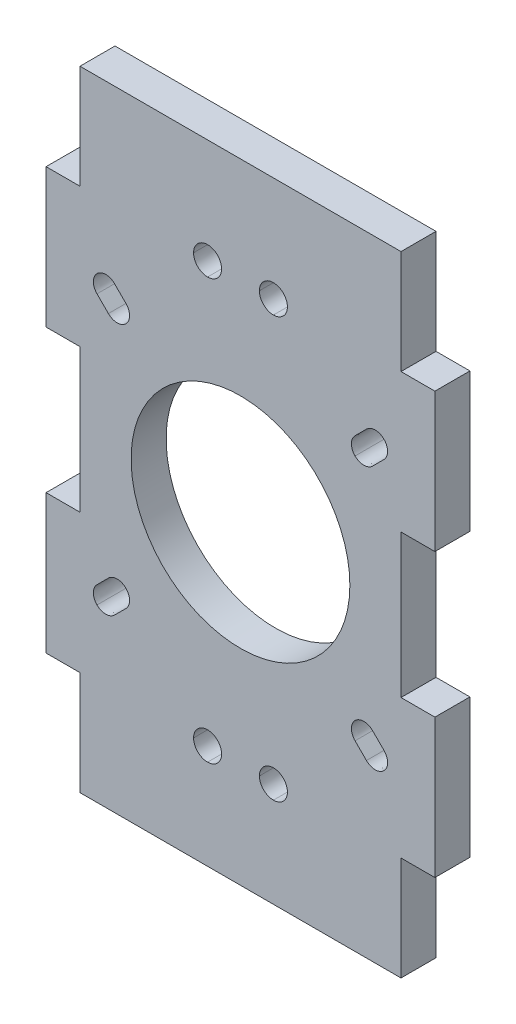
from build123d import *

# Parameters (mm, degrees)
MODEL_R             = 19.8387
BOSS_EXTRUDE1_DEPTH = 6.35


with BuildPart() as part:
    # Model → Boss-Extrude1 (new body)
    with BuildSketch(Plane.XY):
        Polygon((-20.5954, 132.4124), (-26.7451, 132.4124), (-26.7451, 151.262), (-84.9649, 151.262), (-84.9649, 132.4124), (-91.1147, 132.4124), (-91.1147, 107.2136), (-84.9649, 107.2136), (-84.9649, 81.2129), (-91.1147, 81.2129), (-91.1147, 56.0124), (-84.9649, 56.0124), (-84.9649, 37.1628), (-26.7451, 37.1628), (-26.7451, 56.0124), (-20.5954, 56.0124), (-20.5954, 81.2129), (-26.7451, 81.2129), (-26.7451, 107.2136), (-20.5954, 107.2136), align=None)
        with Locations((-55.8552, 94.2124)):
            Circle(MODEL_R, mode=Mode.SUBTRACT)
        with BuildLine():
            Line((-76.6319, 70.2547), (-78.6976, 68.1899))
            add(Edge.make_bspline(
                [(-78.6976, 68.1899), (-79.578, 67.3086), (-80.9971, 67.3086), (-81.878, 68.1903)],
                knots=[0.142857143, 0.142857143, 0.142857143, 0.142857143, 0.285714286, 0.285714286, 0.285714286, 0.285714286], degree=3))
            add(Edge.make_bspline(
                [(-81.878, 68.1903), (-82.7596, 69.0707), (-82.7601, 70.4902), (-81.878, 71.3707)],
                knots=[0.285714286, 0.285714286, 0.285714286, 0.285714286, 0.428571429, 0.428571429, 0.428571429, 0.428571429], degree=3))
            Line((-81.878, 71.3707), (-79.8123, 73.4364))
            add(Edge.make_bspline(
                [(-79.8123, 73.4364), (-78.9314, 74.3172), (-77.5119, 74.3172), (-76.6315, 73.4364)],
                knots=[0.571428571, 0.571428571, 0.571428571, 0.571428571, 0.714285714, 0.714285714, 0.714285714, 0.714285714], degree=3))
            add(Edge.make_bspline(
                [(-76.6315, 73.4364), (-75.7498, 72.5547), (-75.7498, 71.1368), (-76.6319, 70.2547)],
                knots=[0.714285714, 0.714285714, 0.714285714, 0.714285714, 1, 1, 1, 1], degree=3))
        make_face(mode=Mode.SUBTRACT)
        with BuildLine():
            Line((-29.8321, 117.0554), (-31.897, 114.9897))
            add(Edge.make_bspline(
                [(-31.897, 114.9897), (-32.7791, 114.1076), (-34.1965, 114.1076), (-35.0782, 114.9897)],
                knots=[0.142857143, 0.142857143, 0.142857143, 0.142857143, 0.285714286, 0.285714286, 0.285714286, 0.285714286], degree=3))
            add(Edge.make_bspline(
                [(-35.0782, 114.9897), (-35.959, 115.8705), (-35.959, 117.2896), (-35.0782, 118.1705)],
                knots=[0.285714286, 0.285714286, 0.285714286, 0.285714286, 0.428571429, 0.428571429, 0.428571429, 0.428571429], degree=3))
            Line((-35.0782, 118.1705), (-33.0129, 120.2357))
            add(Edge.make_bspline(
                [(-33.0129, 120.2357), (-32.1324, 121.1178), (-30.7129, 121.1178), (-29.8321, 120.2357)],
                knots=[0.571428571, 0.571428571, 0.571428571, 0.571428571, 0.714285714, 0.714285714, 0.714285714, 0.714285714], degree=3))
            add(Edge.make_bspline(
                [(-29.8321, 120.2357), (-28.95, 119.3553), (-28.9504, 117.9362), (-29.8321, 117.0554)],
                knots=[0.714285714, 0.714285714, 0.714285714, 0.714285714, 1, 1, 1, 1], degree=3))
        make_face(mode=Mode.SUBTRACT)
        with BuildLine():
            Line((-29.8321, 71.3707), (-31.8965, 73.4364))
            add(Edge.make_bspline(
                [(-31.8965, 73.4364), (-32.7786, 74.3172), (-34.1969, 74.3172), (-35.0786, 73.4364)],
                knots=[0.142857143, 0.142857143, 0.142857143, 0.142857143, 0.285714286, 0.285714286, 0.285714286, 0.285714286], degree=3))
            add(Edge.make_bspline(
                [(-35.0786, 73.4364), (-35.959, 72.5547), (-35.959, 71.1364), (-35.0786, 70.2543)],
                knots=[0.285714286, 0.285714286, 0.285714286, 0.285714286, 0.428571429, 0.428571429, 0.428571429, 0.428571429], degree=3))
            Line((-35.0786, 70.2543), (-33.0129, 68.1899))
            add(Edge.make_bspline(
                [(-33.0129, 68.1899), (-32.1324, 67.3082), (-30.7129, 67.3086), (-29.8325, 68.1903)],
                knots=[0.571428571, 0.571428571, 0.571428571, 0.571428571, 0.714285714, 0.714285714, 0.714285714, 0.714285714], degree=3))
            add(Edge.make_bspline(
                [(-29.8325, 68.1903), (-28.9504, 69.0707), (-28.95, 70.4902), (-29.8321, 71.3707)],
                knots=[0.714285714, 0.714285714, 0.714285714, 0.714285714, 1, 1, 1, 1], degree=3))
        make_face(mode=Mode.SUBTRACT)
        with BuildLine():
            Line((-76.6319, 118.1705), (-78.6976, 120.2357))
            add(Edge.make_bspline(
                [(-78.6976, 120.2357), (-79.578, 121.1178), (-80.9975, 121.1178), (-81.878, 120.2357)],
                knots=[0.142857143, 0.142857143, 0.142857143, 0.142857143, 0.285714286, 0.285714286, 0.285714286, 0.285714286], degree=3))
            add(Edge.make_bspline(
                [(-81.878, 120.2357), (-82.7601, 119.3553), (-82.7601, 117.9358), (-81.878, 117.0554)],
                knots=[0.285714286, 0.285714286, 0.285714286, 0.285714286, 0.428571429, 0.428571429, 0.428571429, 0.428571429], degree=3))
            Line((-81.878, 117.0554), (-79.8127, 114.9897))
            add(Edge.make_bspline(
                [(-79.8127, 114.9897), (-78.9322, 114.1076), (-77.5123, 114.1076), (-76.6319, 114.9897)],
                knots=[0.571428571, 0.571428571, 0.571428571, 0.571428571, 0.714285714, 0.714285714, 0.714285714, 0.714285714], degree=3))
            add(Edge.make_bspline(
                [(-76.6319, 114.9897), (-75.7498, 115.8705), (-75.7498, 117.29), (-76.6319, 118.1705)],
                knots=[0.714285714, 0.714285714, 0.714285714, 0.714285714, 1, 1, 1, 1], degree=3))
        make_face(mode=Mode.SUBTRACT)
        with BuildLine():
            add(Edge.make_bspline(
                [(-61.8264, 129.7262), (-60.4231, 129.7262), (-59.2852, 130.8633), (-59.2852, 132.2662)],
                knots=[0, 0, 0, 0, 0.2, 0.2, 0.2, 0.2], degree=3))
            add(Edge.make_bspline(
                [(-59.2852, 132.2662), (-59.2852, 133.6691), (-60.4231, 134.8074), (-61.8264, 134.8074)],
                knots=[0.2, 0.2, 0.2, 0.2, 0.4, 0.4, 0.4, 0.4], degree=3))
            add(Edge.make_bspline(
                [(-61.8264, 134.8074), (-63.2289, 134.8074), (-64.366, 133.6691), (-64.366, 132.2662)],
                knots=[0.4, 0.4, 0.4, 0.4, 0.6, 0.6, 0.6, 0.6], degree=3))
            add(Edge.make_bspline(
                [(-64.366, 132.2662), (-64.366, 130.8633), (-63.2289, 129.7262), (-61.8264, 129.7262)],
                knots=[0.6, 0.6, 0.6, 0.6, 1, 1, 1, 1], degree=3))
        make_face(mode=Mode.SUBTRACT)
        with BuildLine():
            add(Edge.make_bspline(
                [(-61.8264, 53.5264), (-60.4231, 53.5264), (-59.2852, 54.6635), (-59.2852, 56.0664)],
                knots=[0, 0, 0, 0, 0.2, 0.2, 0.2, 0.2], degree=3))
            add(Edge.make_bspline(
                [(-59.2852, 56.0664), (-59.2852, 57.4693), (-60.4231, 58.6076), (-61.8264, 58.6076)],
                knots=[0.2, 0.2, 0.2, 0.2, 0.4, 0.4, 0.4, 0.4], degree=3))
            add(Edge.make_bspline(
                [(-61.8264, 58.6076), (-63.2289, 58.6076), (-64.366, 57.4693), (-64.366, 56.0664)],
                knots=[0.4, 0.4, 0.4, 0.4, 0.6, 0.6, 0.6, 0.6], degree=3))
            add(Edge.make_bspline(
                [(-64.366, 56.0664), (-64.366, 54.6635), (-63.2289, 53.5264), (-61.8264, 53.5264)],
                knots=[0.6, 0.6, 0.6, 0.6, 1, 1, 1, 1], degree=3))
        make_face(mode=Mode.SUBTRACT)
        with BuildLine():
            add(Edge.make_bspline(
                [(-49.884, 129.7262), (-48.4812, 129.7262), (-47.3445, 130.8633), (-47.3445, 132.2662)],
                knots=[0, 0, 0, 0, 0.2, 0.2, 0.2, 0.2], degree=3))
            add(Edge.make_bspline(
                [(-47.3445, 132.2662), (-47.3445, 133.6691), (-48.4812, 134.8074), (-49.884, 134.8074)],
                knots=[0.2, 0.2, 0.2, 0.2, 0.4, 0.4, 0.4, 0.4], degree=3))
            add(Edge.make_bspline(
                [(-49.884, 134.8074), (-51.2869, 134.8074), (-52.424, 133.6691), (-52.424, 132.2662)],
                knots=[0.4, 0.4, 0.4, 0.4, 0.6, 0.6, 0.6, 0.6], degree=3))
            add(Edge.make_bspline(
                [(-52.424, 132.2662), (-52.424, 130.8633), (-51.2869, 129.7262), (-49.884, 129.7262)],
                knots=[0.6, 0.6, 0.6, 0.6, 1, 1, 1, 1], degree=3))
        make_face(mode=Mode.SUBTRACT)
        with BuildLine():
            add(Edge.make_bspline(
                [(-49.884, 53.5264), (-48.4812, 53.5264), (-47.3445, 54.6635), (-47.3445, 56.0664)],
                knots=[0, 0, 0, 0, 0.2, 0.2, 0.2, 0.2], degree=3))
            add(Edge.make_bspline(
                [(-47.3445, 56.0664), (-47.3445, 57.4693), (-48.4812, 58.6076), (-49.884, 58.6076)],
                knots=[0.2, 0.2, 0.2, 0.2, 0.4, 0.4, 0.4, 0.4], degree=3))
            add(Edge.make_bspline(
                [(-49.884, 58.6076), (-51.2869, 58.6076), (-52.424, 57.4693), (-52.424, 56.0664)],
                knots=[0.4, 0.4, 0.4, 0.4, 0.6, 0.6, 0.6, 0.6], degree=3))
            add(Edge.make_bspline(
                [(-52.424, 56.0664), (-52.424, 54.6635), (-51.2869, 53.5264), (-49.884, 53.5264)],
                knots=[0.6, 0.6, 0.6, 0.6, 1, 1, 1, 1], degree=3))
        make_face(mode=Mode.SUBTRACT)
    extrude(amount=BOSS_EXTRUDE1_DEPTH)


solid = part.part
